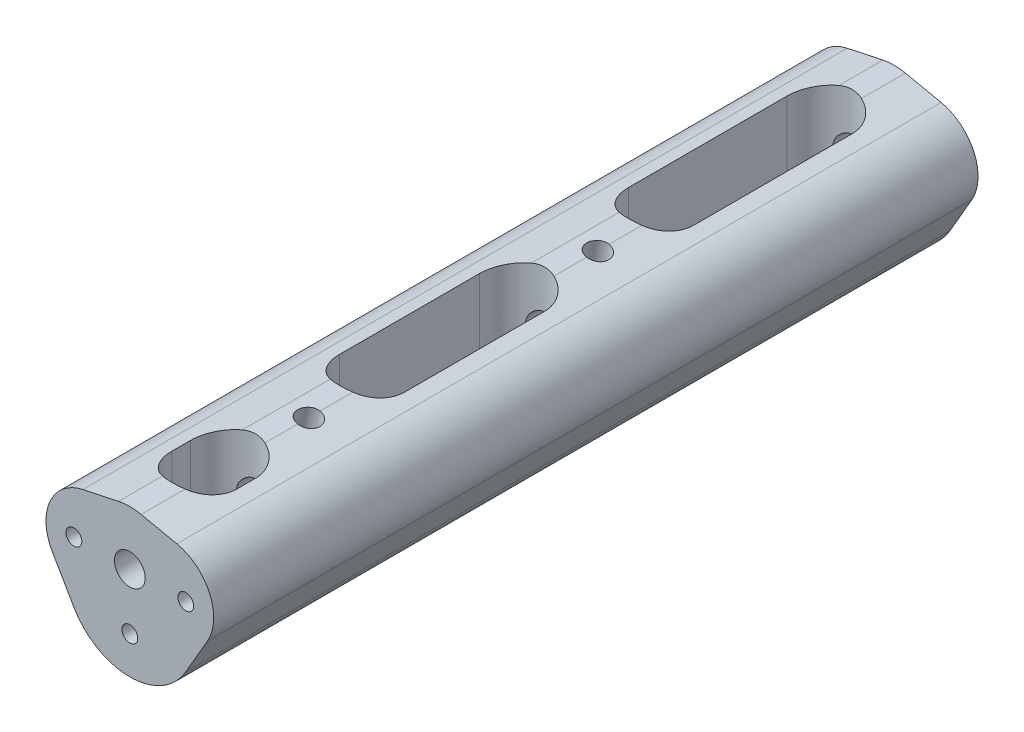
from build123d import *

# Parameters (mm, degrees)
BODYSKE_R      = 0.825
BODYSKE_R_2    = 0.425
BODY_DEPTH     = 41
HOLE_PROFILE_R = 0.6
CUT_DEPTH      = 42.54816492
CUT_DEPTH_BACK = 42.54816492


with BuildPart() as part:
    # BodySke → Body (new body)
    with BuildSketch(Plane.XY):
        with BuildLine():
            Line((4.165063509, -1.25), (3, -3.267949192))
            ThreePointArc((3, -3.267949192), (0, -5), (-3, -3.267949192))
            Line((-3, -3.267949192), (-4.165063509, -1.25))
            ThreePointArc((-4.165063509, -1.25), (-4.283863644, 1.016841608), (-2.519779227, 2.445369002))
            Line((-2.519779227, 2.445369002), (-0.606233769, 2.852105645))
            ThreePointArc((-0.606233769, 2.852105645), (0, 2.915823382), (0.606233769, 2.852105645))
            Line((0.606233769, 2.852105645), (2.519779227, 2.445369002))
            ThreePointArc((2.519779227, 2.445369002), (4.283863644, 1.016841608), (4.165063509, -1.25))
        make_face()
        Circle(BODYSKE_R, mode=Mode.SUBTRACT)
        with Locations((-3, 0)):
            Circle(BODYSKE_R_2, mode=Mode.SUBTRACT)
        with Locations((3, 0)):
            Circle(BODYSKE_R_2, mode=Mode.SUBTRACT)
        with Locations((0, -3)):
            Circle(BODYSKE_R_2, mode=Mode.SUBTRACT)
    extrude(amount=BODY_DEPTH)

    # Hole: sweep along a path in HoleSke
    with BuildLine() as hole_path:  # in the path sketch's own coordinates; laid on its plane below (add() does not lay a ready-made edge on the line's plane)
        add(Edge.make_bspline(
            [(10.5, 0), (15.119948081, 0), (16.5, 0.035966381), (16.5, 1.704499781)],
            knots=[0, 0, 0, 0, 1, 1, 1, 1], degree=3))
        Line((16.5, 1.704499781), (16.5, 3.03748751))
        ThreePointArc((16.5, 3.03748751), (24.25, 10.78748751), (32, 3.03748751))
        Line((32, 3.03748751), (32, 1.704499781))
        add(Edge.make_bspline(
            [(32, 1.704499781), (32, 0.035966381), (30.619948081, 0), (26, 0)],
            knots=[0, 0, 0, 0, 1, 1, 1, 1], degree=3))
    # Hole profile (on start of the path) → Hole (sweep, cut)
    with BuildSketch(Plane.XY.offset(10.5)):
        Circle(HOLE_PROFILE_R)
    sweep(path=Plane(origin=(0, 0, 0), x_dir=(0, 0, 1), z_dir=(-0.9781476007338055, 0.2079116908177607, 0)) * hole_path.line, mode=Mode.SUBTRACT)

    # CutSke → Cut (cut, two sides: drawn at the far end of the back side and taken through both)
    with BuildSketch(Plane(origin=(0, 0, 0), x_dir=(1, 0, 0), z_dir=(0, 1, 0)).offset(-CUT_DEPTH_BACK)):
        with BuildLine():
            Line((1.75, -4), (1.75, -12.5))
            ThreePointArc((1.75, -12.5), (0, -14.25), (-1.75, -12.5))
            Line((-1.75, -12.5), (-1.75, -4))
            ThreePointArc((-1.75, -4), (0, -2.25), (1.75, -4))
        make_face()
        with BuildLine():
            Line((-1.75, -28), (-1.75, -20.5))
            ThreePointArc((-1.75, -20.5), (0, -18.75), (1.75, -20.5))
            Line((1.75, -20.5), (1.75, -28))
            ThreePointArc((1.75, -28), (0, -29.75), (-1.75, -28))
        make_face()
        with BuildLine():
            Line((-1.75, -37), (-1.75, -36))
            ThreePointArc((-1.75, -36), (0, -34.25), (1.75, -36))
            Line((1.75, -36), (1.75, -37))
            ThreePointArc((1.75, -37), (0, -38.75), (-1.75, -37))
        make_face()
    extrude(amount=CUT_DEPTH + CUT_DEPTH_BACK, mode=Mode.SUBTRACT)


solid = part.part
